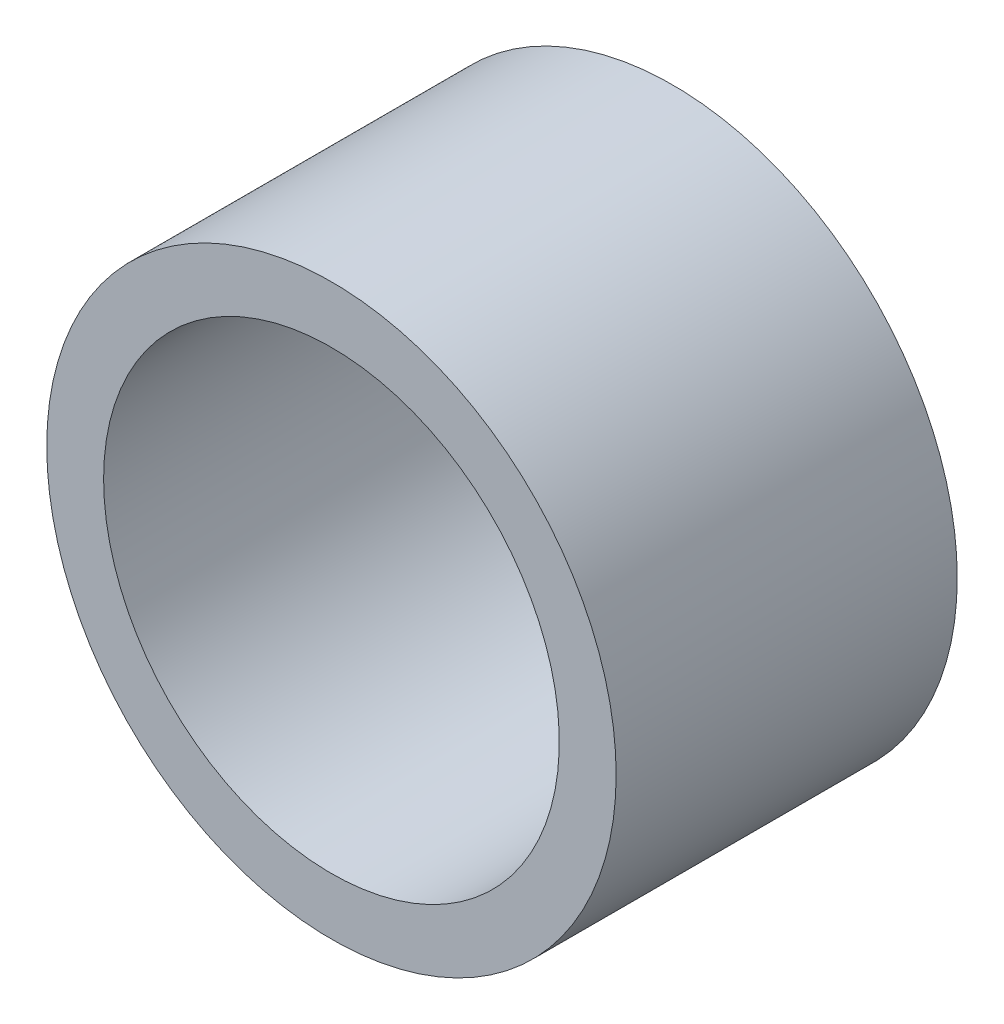
from build123d import *

# Parameters (mm, degrees)
SKETCH1_R      = 15.9004
SKETCH1_R_2    = 12.7254
EXTRUDE1_DEPTH = 9.525


with BuildPart() as part:
    # Sketch1 → Extrude1 (new, symmetric)
    with BuildSketch(Plane.XY):
        with Locations(Location((0, 0, 0), (0, 0, 180))):
            Circle(SKETCH1_R)
        with Locations(Location((0, 0, 0), (0, 0, 180))):
            Circle(SKETCH1_R_2, mode=Mode.SUBTRACT)
    extrude(amount=EXTRUDE1_DEPTH, both=True)


solid = part.part
